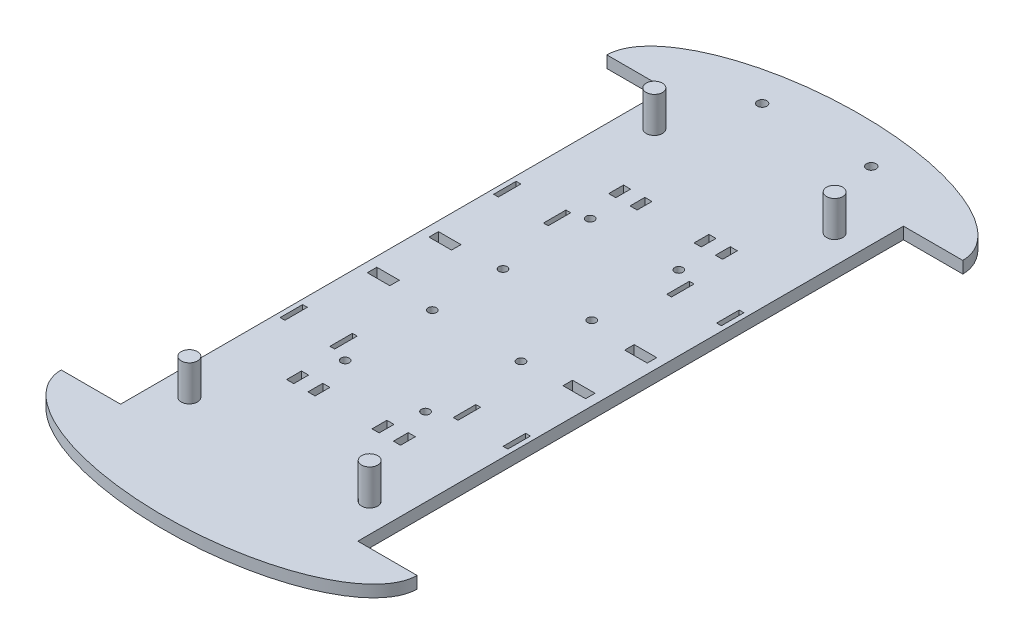
from build123d import *

# Parameters (mm, degrees)
BOSS_EXTRUDE10_DEPTH = 5
SKETCH9_W            = 2
SKETCH9_H            = 9.5
CUT_EXTRUDE2_DEPTH   = 165.842149126
SKETCH10_W           = 3
SKETCH10_H           = 6.25
CUT_EXTRUDE3_DEPTH   = 165.842149126
SKETCH11_W           = 9.5
SKETCH11_H           = 4
CUT_EXTRUDE4_DEPTH   = 165.842149126
SKETCH13_R           = 3.415
BOSS_EXTRUDE11_DEPTH = 15
SKETCH14_R           = 1.75
CUT_EXTRUDE5_DEPTH   = 166.447677915
SKETCH15_R           = 2
CUT_EXTRUDE6_DEPTH   = 166.447677915


with BuildPart() as part:
    # Sketch6 → Boss-Extrude10 (new body)
    with BuildSketch(Plane(origin=(0, 0, 0), x_dir=(1, 0, 0), z_dir=(0, 1, 0))):
        with BuildLine():
            Line((-75, 115), (-50, 115))
            Line((-50, 115), (50, 115))
            Line((50, 115), (75, 115))
            add(Edge.make_bspline(
                [(75, 115), (75, 146.706966716), (0, 146.706966716), (-75, 146.706966716), (-75, 115)],
                knots=[0, 0, 0, 1.570796327, 1.570796327, 3.141592654, 3.141592654, 3.141592654], degree=2, weights=[1, 0.707106781, 1, 0.707106781, 1]))
        make_face()
        with BuildLine():
            Line((-50, 115), (-50, 91.367022354))
            add(Edge.make_bspline(
                [(-50, 91.367022354), (0, 72.460640237), (50, 91.367022354)],
                knots=[3.982661324, 3.982661324, 3.982661324, 5.442116637, 5.442116637, 5.442116637], degree=2, weights=[1, 0.745355992, 1]))
            Line((50, 91.367022354), (50, 115))
            Line((50, 115), (-50, 115))
        make_face()
        with BuildLine():
            Line((-50, 91.367022354), (-50, -91.367022354))
            add(Edge.make_bspline(
                [(50, -91.367022354), (0, -72.460640237), (-50, -91.367022354)],
                knots=[0.841068671, 0.841068671, 0.841068671, 2.300523983, 2.300523983, 2.300523983], degree=2, weights=[1, 0.745355992, 1]))
            Line((50, -91.367022354), (50, 91.367022354))
            add(Edge.make_bspline(
                [(-50, 91.367022354), (0, 72.460640237), (50, 91.367022354)],
                knots=[3.982661324, 3.982661324, 3.982661324, 5.442116637, 5.442116637, 5.442116637], degree=2, weights=[1, 0.745355992, 1]))
        make_face()
        with BuildLine():
            Line((-50, -91.367022354), (-50, -115))
            Line((-50, -115), (50, -115))
            Line((50, -115), (50, -91.367022354))
            add(Edge.make_bspline(
                [(50, -91.367022354), (0, -72.460640237), (-50, -91.367022354)],
                knots=[0.841068671, 0.841068671, 0.841068671, 2.300523983, 2.300523983, 2.300523983], degree=2, weights=[1, 0.745355992, 1]))
        make_face()
        with BuildLine():
            Line((-50, -115), (-75, -115))
            add(Edge.make_bspline(
                [(-75, -115), (-75, -146.706966716), (0, -146.706966716), (75, -146.706966716), (75, -115)],
                knots=[3.141592654, 3.141592654, 3.141592654, 4.71238898, 4.71238898, 6.283185307, 6.283185307, 6.283185307], degree=2, weights=[1, 0.707106781, 1, 0.707106781, 1]))
            Line((75, -115), (50, -115))
            Line((50, -115), (-50, -115))
        make_face()
    extrude(amount=BOSS_EXTRUDE10_DEPTH)

    # Sketch9 → Cut-Extrude2 (cut, through all)
    with BuildSketch(Plane(origin=(0, 5, 0), x_dir=(1, 0, 0), z_dir=(0, 1, 0))):
        with Locations((-47, 45)):
            Rectangle(SKETCH9_W, SKETCH9_H)
        with Locations((-47, -45)):
            Rectangle(SKETCH9_W, SKETCH9_H)
        with Locations((47, 45)):
            Rectangle(SKETCH9_W, SKETCH9_H)
        with Locations((47, -45)):
            Rectangle(SKETCH9_W, SKETCH9_H)
        with Locations((-26, 45)):
            Rectangle(SKETCH9_W, SKETCH9_H)
        with Locations((-26, -45)):
            Rectangle(SKETCH9_W, SKETCH9_H)
        with Locations((26, -45)):
            Rectangle(SKETCH9_W, SKETCH9_H)
        with Locations((26, 45)):
            Rectangle(SKETCH9_W, SKETCH9_H)
    extrude(amount=-CUT_EXTRUDE2_DEPTH, mode=Mode.SUBTRACT)

    # Sketch10 → Cut-Extrude3 (cut, through all)
    with BuildSketch(Plane(origin=(0, 5, 0), x_dir=(1, 0, 0), z_dir=(0, 1, 0))):
        with Locations((-22.5, -67.875)):
            Rectangle(SKETCH10_W, SKETCH10_H)
        with Locations((-13.5, -67.875)):
            Rectangle(SKETCH10_W, SKETCH10_H)
        with Locations((13.5, -67.875)):
            Rectangle(SKETCH10_W, SKETCH10_H)
        with Locations((22.5, -67.875)):
            Rectangle(SKETCH10_W, SKETCH10_H)
        with Locations((22.5, 67.875)):
            Rectangle(SKETCH10_W, SKETCH10_H)
        with Locations((13.5, 67.875)):
            Rectangle(SKETCH10_W, SKETCH10_H)
        with Locations((-13.5, 67.875)):
            Rectangle(SKETCH10_W, SKETCH10_H)
        with Locations((-22.5, 67.875)):
            Rectangle(SKETCH10_W, SKETCH10_H)
    extrude(amount=-CUT_EXTRUDE3_DEPTH, mode=Mode.SUBTRACT)

    # Sketch11 → Cut-Extrude4 (cut, through all)
    with BuildSketch(Plane(origin=(0, 5, 0), x_dir=(1, 0, 0), z_dir=(0, 1, 0))):
        with Locations((41.25, -13)):
            Rectangle(SKETCH11_W, SKETCH11_H)
        with Locations((-41.25, -13)):
            Rectangle(SKETCH11_W, SKETCH11_H)
        with Locations((41.25, 13)):
            Rectangle(SKETCH11_W, SKETCH11_H)
        with Locations((-41.25, 13)):
            Rectangle(SKETCH11_W, SKETCH11_H)
    extrude(amount=-CUT_EXTRUDE4_DEPTH, mode=Mode.SUBTRACT)

    # Sketch13 → Boss-Extrude11 (add)
    with BuildSketch(Plane(origin=(0, 5, 0), x_dir=(1, 0, 0), z_dir=(0, 1, 0))):
        with Locations(Location((-38, 98, 0), (0, 0, 270))):
            Circle(SKETCH13_R)
        with Locations(Location((38, 98, 0), (0, 0, 90))):
            Circle(SKETCH13_R)
        with Locations(Location((38, -98, 0), (0, 0, 270))):
            Circle(SKETCH13_R)
        with Locations(Location((-38, -98, 0), (0, 0, 90))):
            Circle(SKETCH13_R)
    extrude(amount=BOSS_EXTRUDE11_DEPTH)

    # Sketch14 → Cut-Extrude5 (cut, through all)
    with BuildSketch(Plane(origin=(0, 5, 0), x_dir=(1, 0, 0), z_dir=(0, 1, 0))):
        with Locations(Location((-18.743448707, 14.950188424, 0), (0, 0, 270))):
            Circle(SKETCH14_R)
        with Locations(Location((-18.743448707, 51.690188424, 0), (0, 0, 270))):
            Circle(SKETCH14_R)
        with Locations(Location((18.636551293, 51.690188424, 0), (0, 0, 270))):
            Circle(SKETCH14_R)
        with Locations(Location((18.636551293, 14.950188424, 0), (0, 0, 270))):
            Circle(SKETCH14_R)
        with Locations(Location((-18.64, -51.69, 0), (0, 0, 270))):
            Circle(SKETCH14_R)
        with Locations(Location((-18.64, -14.95, 0), (0, 0, 270))):
            Circle(SKETCH14_R)
        with Locations(Location((18.74, -14.95, 0), (0, 0, 270))):
            Circle(SKETCH14_R)
        with Locations(Location((16.99, -53.44, 0), (0, 0, 270))):
            Circle(SKETCH14_R)
    extrude(amount=-CUT_EXTRUDE5_DEPTH, mode=Mode.SUBTRACT)

    # Sketch15 → Cut-Extrude6 (cut, through all)
    with BuildSketch(Plane(origin=(0, 5, 0), x_dir=(1, 0, 0), z_dir=(0, 1, 0))):
        with Locations(Location((-24.563162079, 130, 0), (0, 0, 270))):
            Circle(SKETCH15_R)
        with Locations(Location((21.416837921, 130, 0), (0, 0, 270))):
            Circle(SKETCH15_R)
    extrude(amount=-CUT_EXTRUDE6_DEPTH, mode=Mode.SUBTRACT)


solid = part.part
